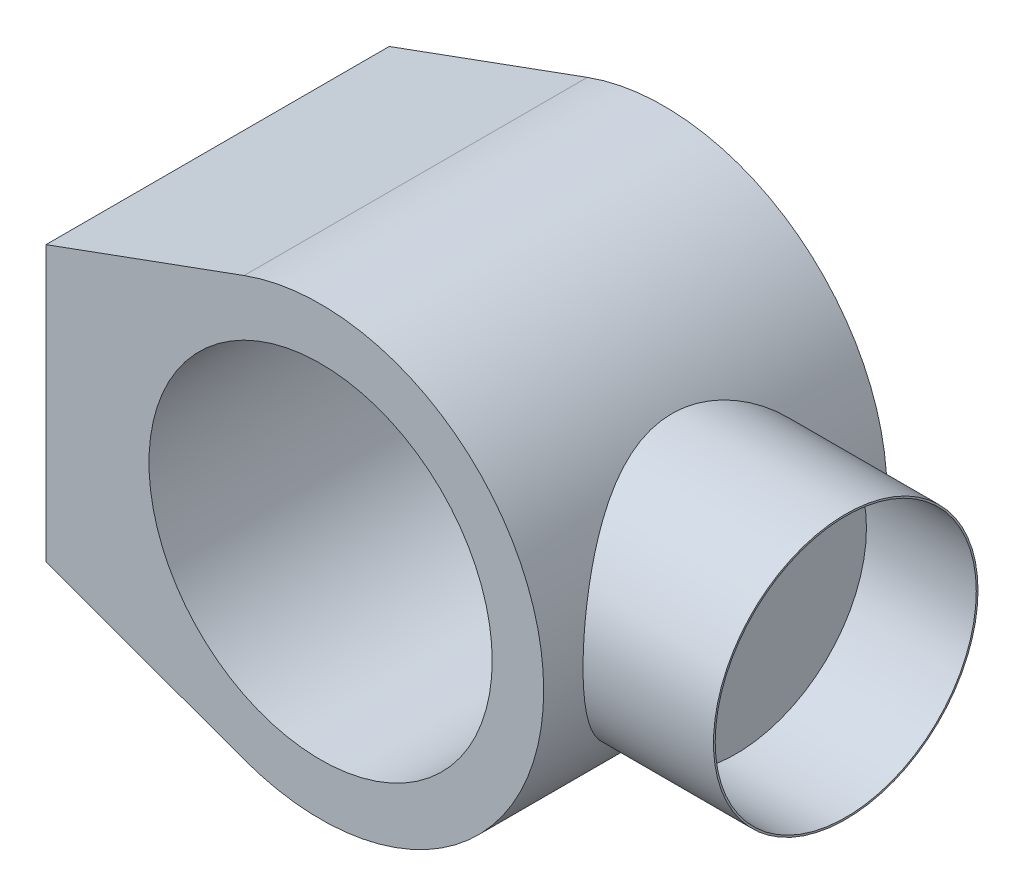
from build123d import *

# Parameters (mm, degrees)
SKETCH1_R                = 50
BOSS_EXTRUDE1_DEPTH      = 50
BOSS_EXTRUDE2_REACH      = 202.534
BOSS_EXTRUDE2_END_RADIUS = 65
SKETCH2_R                = 38.535
SKETCH2_R_2              = 38.035
BOSS_EXTRUDE3_START      = 3
SKETCH4_R                = 38.035
BOSS_EXTRUDE3_DEPTH      = 3


with BuildPart() as part:
    # Sketch1 → Boss-Extrude1 (new, symmetric)
    with BuildSketch(Plane.XY):
        with BuildLine():
            Line((-80, 40), (-80, -40))
            Line((-80, -40), (-22.281665693, -61.061668614))
            ThreePointArc((-22.281665693, -61.061668614), (65, 0), (-22.281665693, 61.061668614))
            Line((-22.281665693, 61.061668614), (-80, 40))
        make_face()
        Circle(SKETCH1_R, mode=Mode.SUBTRACT)
    extrude(amount=BOSS_EXTRUDE1_DEPTH, both=True)

    # Boss-Extrude2: up to this cylinder (the profile starts outside it)
    boss_extrude2_end = Plane(origin=(0, 0, 38.426007), z_dir=(0, 0, -1)) * Cylinder(BOSS_EXTRUDE2_END_RADIUS, 536.068, mode=Mode.PRIVATE)
    # Sketch2 → Boss-Extrude2 (add, up to the surface)
    with BuildSketch(Plane(origin=(103, 0, 0), x_dir=(0, 0, -1), z_dir=(1, 0, 0)), mode=Mode.PRIVATE) as boss_extrude2_sk1:
        Circle(SKETCH2_R)
        Circle(SKETCH2_R_2, mode=Mode.SUBTRACT)
    boss_extrude2_tool1 = extrude(boss_extrude2_sk1.sketch, amount=-BOSS_EXTRUDE2_REACH, mode=Mode.PRIVATE) - boss_extrude2_end
    add(boss_extrude2_tool1.solids().sort_by_distance((103, 0, 38.426007))[0])

    # Sketch4 → Boss-Extrude3 (add)
    with BuildSketch(Plane(origin=(68, 0, 0), x_dir=(0, 0, -1), z_dir=(1, 0, 0)).offset(BOSS_EXTRUDE3_START)):
        Circle(SKETCH4_R)
    extrude(amount=-BOSS_EXTRUDE3_DEPTH)


solid = part.part
